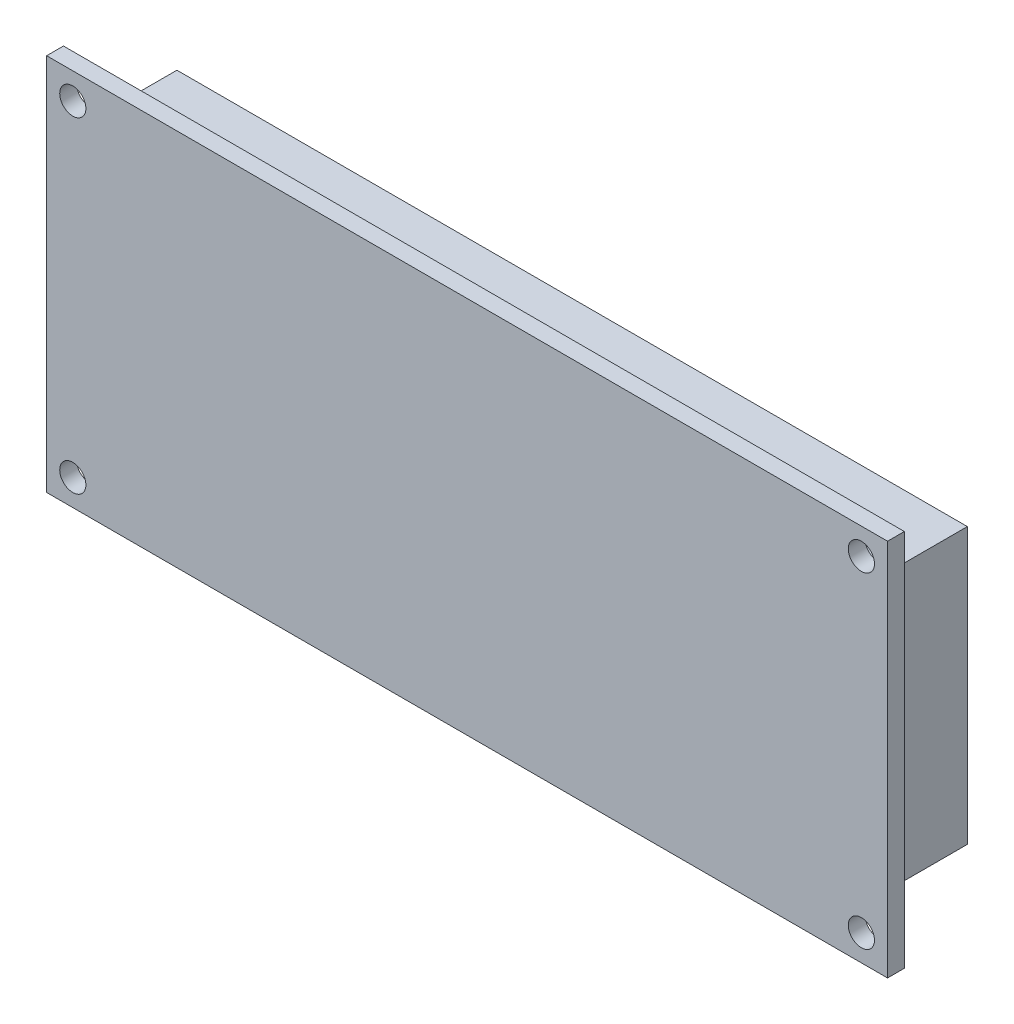
from build123d import *

# Parameters (mm, degrees)
SKETCH1_W           = 80.01
SKETCH1_H           = 35.9918
BOSS_EXTRUDE1_DEPTH = 1.6002
SKETCH1_3_W         = 75.2094
SKETCH1_3_H         = 26.1874
BOSS_EXTRUDE2_DEPTH = 8.3058
SKETCH2_W           = 64.008
SKETCH2_H           = 13.9954
CUT_EXTRUDE1_DEPTH  = 0.254
SKETCH3_R           = 1.2446
CUT_EXTRUDE2_DEPTH  = 2.54


with BuildPart() as part:
    # Sketch1 → Boss-Extrude1 (new body)
    with BuildSketch(Plane.XY):
        with Locations((40.005, 17.9959)):
            Rectangle(SKETCH1_W, SKETCH1_H)
    extrude(amount=BOSS_EXTRUDE1_DEPTH)

    # Sketch1<3> → Boss-Extrude2 (add)
    with BuildSketch(Plane.XY):
        with Locations((40.0939, 17.9959)):
            Rectangle(SKETCH1_3_W, SKETCH1_3_H)
    extrude(amount=-BOSS_EXTRUDE2_DEPTH)

    # Sketch2 → Cut-Extrude1 (cut)
    with BuildSketch(Plane(origin=(0, 0, -8.3058), x_dir=(-1, 0, 0), z_dir=(0, 0, -1))):
        with Locations((-40.0939, 17.9959)):
            Rectangle(SKETCH2_W, SKETCH2_H)
    extrude(amount=-CUT_EXTRUDE1_DEPTH, mode=Mode.SUBTRACT)

    # Sketch3 → Cut-Extrude2 (cut)
    with BuildSketch(Plane(origin=(0, 0, 0), x_dir=(-1, 0, 0), z_dir=(0, 0, -1))):
        with Locations((-77.5208, 2.4892)):
            Circle(SKETCH3_R)
        with Locations((-77.5208, 33.5026)):
            Circle(SKETCH3_R)
        with Locations((-2.4892, 33.5026)):
            Circle(SKETCH3_R)
        with Locations((-2.4892, 2.4892)):
            Circle(SKETCH3_R)
    extrude(amount=-CUT_EXTRUDE2_DEPTH, mode=Mode.SUBTRACT)


solid = part.part
